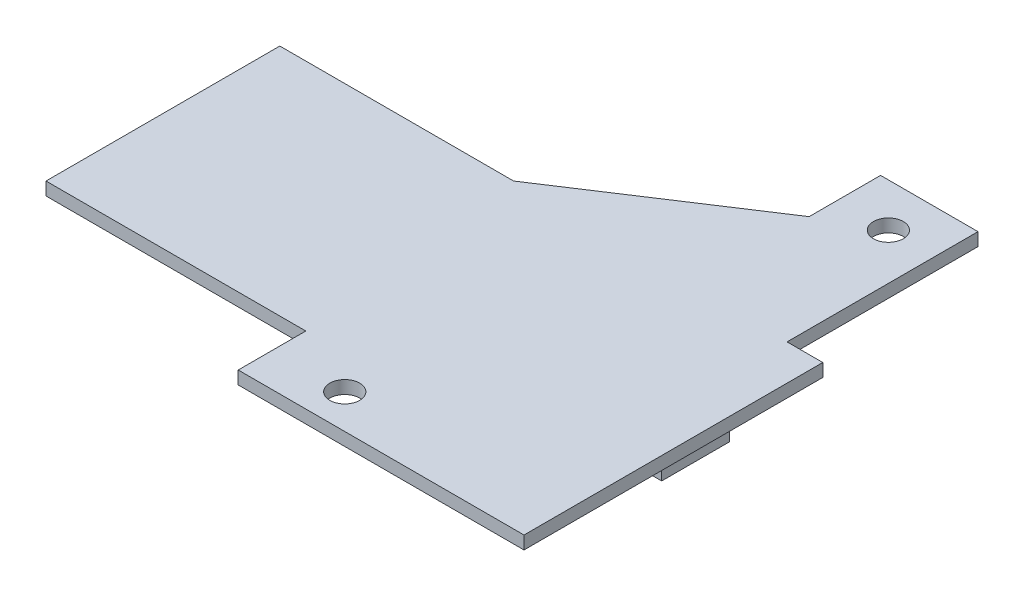
from build123d import *

# Parameters (mm, degrees)
EXTRUDE_1_DEPTH     = 1
SKETCH_2_R          = 1.15
CUT_EXTRUDE_1_DEPTH = 54.115440316
SKETCH_3_R          = 1.15
CUT_EXTRUDE_2_DEPTH = 54.115440316
SKETCH_4_W          = 5.2
SKETCH_4_H          = 5.2
EXTRUDE_2_DEPTH     = 1.7


with BuildPart() as part:
    # Эскиз1 → Бобышка-Вытянуть1 (new body)
    with BuildSketch(Plane(origin=(0, 0, 0), x_dir=(1, 0, 0), z_dir=(0, 1, 0))):
        Polygon((0, 0), (0, 18), (18, 18), (31.75, 27), (31.75, 32.5), (39.25, 32.5), (39.25, 17.8), (42, 17.8), (42, -5.2), (20, -5.2), (20, 0), align=None)
    extrude(amount=EXTRUDE_1_DEPTH)

    # Эскиз2 → Вырез-Вытянуть1 (cut, through all)
    with BuildSketch(Plane(origin=(0, 1, 0), x_dir=(1, 0, 0), z_dir=(0, 1, 0))):
        with Locations(Location((35.7, 29.15, 0), (0, 0, 270))):
            Circle(SKETCH_2_R)
    extrude(amount=-CUT_EXTRUDE_1_DEPTH, mode=Mode.SUBTRACT)

    # Эскиз3 → Вырез-Вытянуть2 (cut, through all)
    with BuildSketch(Plane(origin=(0, 1, 0), x_dir=(1, 0, 0), z_dir=(0, 1, 0))):
        with Locations(Location((25.55, -2.55, 0), (0, 0, 270))):
            Circle(SKETCH_3_R)
    extrude(amount=-CUT_EXTRUDE_2_DEPTH, mode=Mode.SUBTRACT)

    # Эскиз4 → Бобышка-Вытянуть2 (add)
    with BuildSketch(Plane.XZ):
        with Locations((38.4, -9)):
            Rectangle(SKETCH_4_W, SKETCH_4_H)
    extrude(amount=EXTRUDE_2_DEPTH)


solid = part.part
